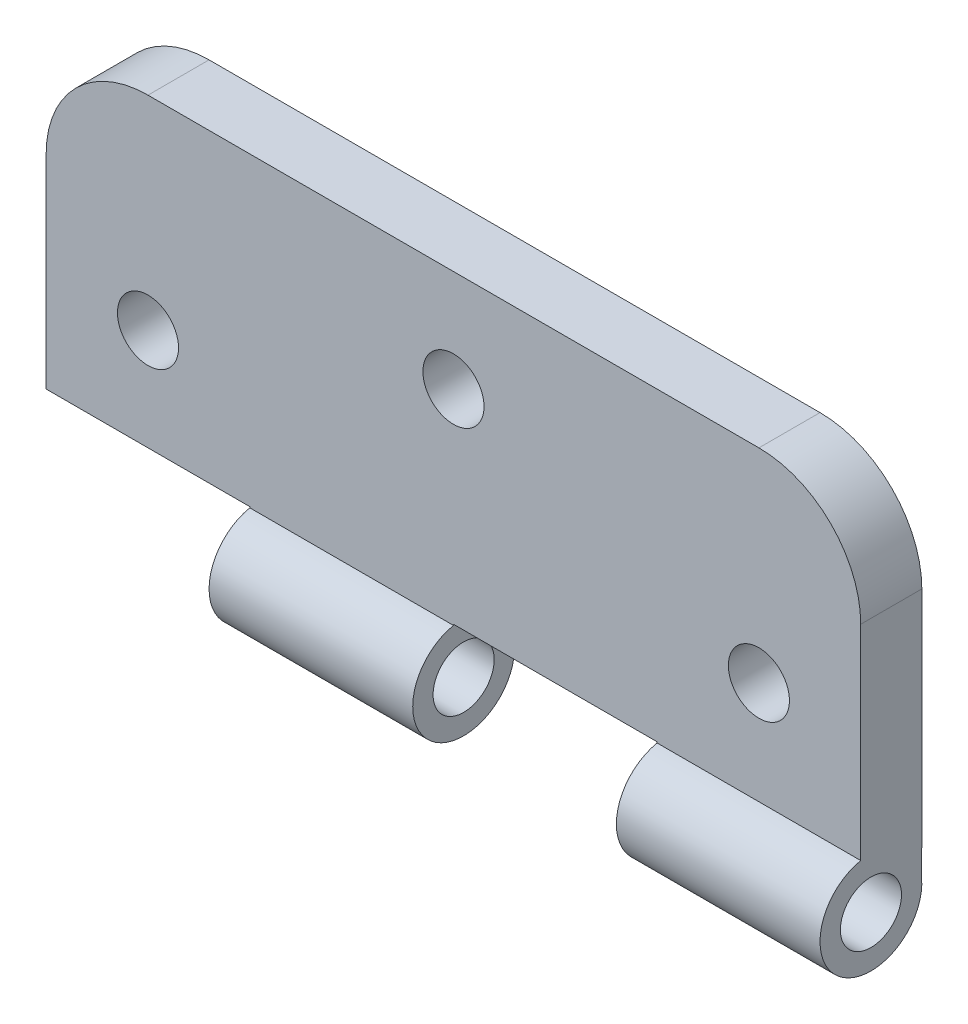
from build123d import *

# Parameters (mm, degrees)
ESQUISSE1_R                = 1.5
BOSS_EXTRU_1_DEPTH         = 3
ESQUISSE2_R                = 1.5
BOSS_EXTRU_2_DEPTH         = 10
R_P_TITION_LIN_AIRE1_COUNT = 2
R_P_TITION_LIN_AIRE1_PITCH = 20


with BuildPart() as part:
    # Esquisse1 → Boss.-Extru.1 (new body)
    with BuildSketch(Plane.XY):
        with BuildLine():
            Line((-15, 7.5), (15, 7.5))
            ThreePointArc((15, 7.5), (18.535533906, 6.035533906), (20, 2.5))
            Line((20, 2.5), (20, -7.5))
            Line((20, -7.5), (-20, -7.5))
            Line((-20, -7.5), (-20, 2.5))
            ThreePointArc((-20, 2.5), (-18.535533906, 6.035533906), (-15, 7.5))
        make_face()
        with Locations((-15, -2.5)):
            Circle(ESQUISSE1_R, mode=Mode.SUBTRACT)
        with Locations(Location((15, -2.5, 0), (0, 0, 180))):
            Circle(ESQUISSE1_R, mode=Mode.SUBTRACT)
        with Locations((0, 2.5)):
            Circle(ESQUISSE1_R, mode=Mode.SUBTRACT)
    extrude(amount=BOSS_EXTRU_1_DEPTH)

    # Esquisse2 → Boss.-Extru.2 (add)
    with BuildSketch(Plane(origin=(20, 0, 0), x_dir=(0, 0, -1), z_dir=(1, 0, 0))):
        with BuildLine():
            Line((-0.009486275, -9.782419246), (0, -7.5))
            Line((0, -7.5), (-2.5, -7.5))
            Line((-2.5, -7.5), (-3, -7.5))
            Line((-3, -7.5), (-3, -7.550510257))
            ThreePointArc((-3, -7.550510257), (-3.995289489, -12.003524231), (-0.009486275, -9.782419246))
        make_face()
        with Locations((-2.5, -10)):
            Circle(ESQUISSE2_R, mode=Mode.SUBTRACT)
    boss_extru_2 = extrude(amount=-BOSS_EXTRU_2_DEPTH)

    # Répétition linéaire1: Boss.-Extru.2 ×2
    with Locations(*[(-i * R_P_TITION_LIN_AIRE1_PITCH, 0, 0) for i in range(1, R_P_TITION_LIN_AIRE1_COUNT)]):
        add(boss_extru_2)


solid = part.part
